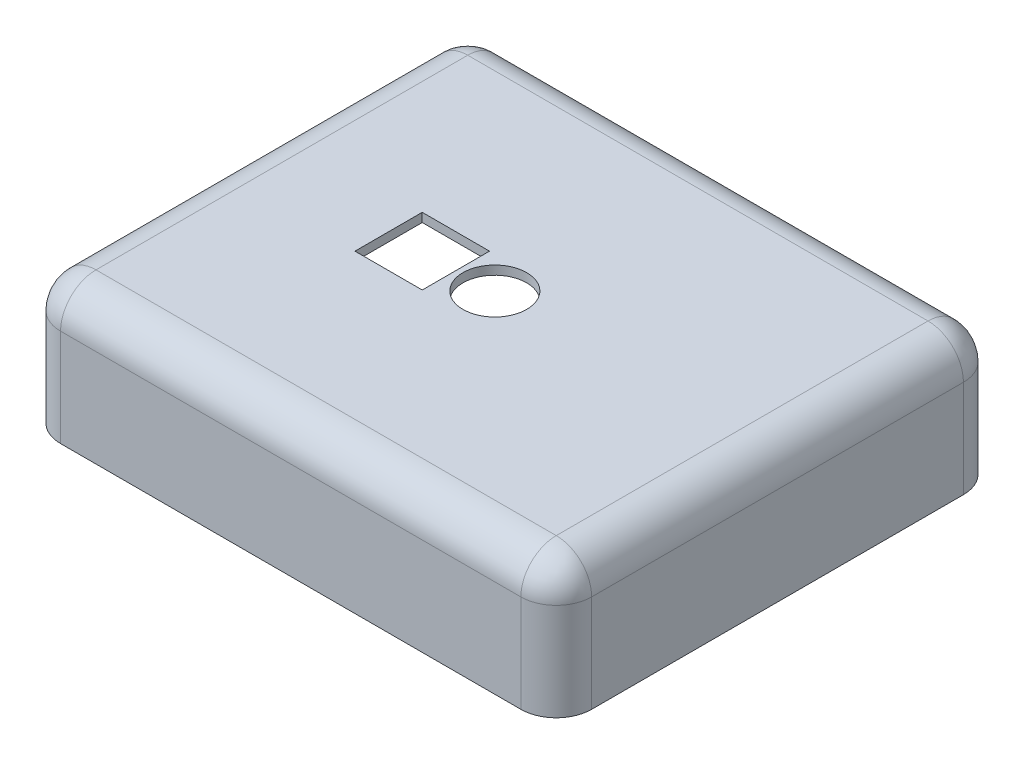
from build123d import *

# Parameters (mm, degrees)
BOSS_EXTRUDE1_DEPTH      = 0.000254
BOSS_EXTRUDE1_DEPTH_BACK = 19.05
SKETCH2_W                = 76.2
SKETCH2_H                = 63.5
SKETCH3_W                = 71.12
SKETCH3_H                = 58.42
CUT_EXTRUDE2_DEPTH       = 17.78
CUT_EXTRUDE3_DEPTH       = 2.54
CUT_EXTRUDE3_DEPTH_BACK  = 102.002933126
SKETCH2_3_R              = 4.572
SKETCH2_3_W              = 9.652
SKETCH2_3_H              = 9.652
FILLET1_R                = 5.08
FILLET2_R                = 5.08
FILLET3_R                = 5.08
FILLET4_R                = 5.08
FILLET5_R                = 5.08
FILLET6_R                = 5.08
CUT_EXTRUDE4_DEPTH       = 5.08


with BuildPart() as part:
    # Sketch2 → Boss-Extrude1 (new, two sides: drawn at the far end of the back side and taken through both)
    with BuildSketch(Plane(origin=(0, 0, 0), x_dir=(1, 0, 0), z_dir=(0, 1, 0)).offset(-BOSS_EXTRUDE1_DEPTH_BACK)):
        with Locations((38.1, 31.75)):
            Rectangle(SKETCH2_W, SKETCH2_H)
    extrude(amount=BOSS_EXTRUDE1_DEPTH + BOSS_EXTRUDE1_DEPTH_BACK)

    # Sketch3 → Cut-Extrude2 (cut)
    with BuildSketch(Plane(origin=(0, -19.05, 0), x_dir=(-1, 0, 0), z_dir=(0, -1, 0))):
        with Locations((-38.1, 31.75)):
            Rectangle(SKETCH3_W, SKETCH3_H)
    extrude(amount=-CUT_EXTRUDE2_DEPTH, mode=Mode.SUBTRACT)

    # Sketch2<3> → Cut-Extrude3 (cut, two sides: drawn at the far end of the back side and taken through both)
    with BuildSketch(Plane(origin=(0, 0, 0), x_dir=(1, 0, 0), z_dir=(0, 1, 0)).offset(-CUT_EXTRUDE3_DEPTH_BACK)):
        with Locations((36.322, 31.064)):
            Circle(SKETCH2_3_R)
        with Locations((26.162, 30.81)):
            Rectangle(SKETCH2_3_W, SKETCH2_3_H)
    extrude(amount=CUT_EXTRUDE3_DEPTH + CUT_EXTRUDE3_DEPTH_BACK, mode=Mode.SUBTRACT)

    # Fillet1
    fillet1_edges = [part.edges().sort_by_distance(p)[0] for p in [
        (76.2, -9.524873, -63.5),
    ]]
    fillet(fillet1_edges, radius=FILLET1_R)

    # Fillet2
    fillet2_edges = [part.edges().sort_by_distance(p)[0] for p in [
        (73.66, -10.16, -60.96),
    ]]
    fillet(fillet2_edges, radius=FILLET2_R)

    # Fillet3
    fillet3_edges = [part.edges().sort_by_distance(p)[0] for p in [
        (76.2, -9.524873, 0),
        (73.66, -10.16, -2.54),
    ]]
    fillet(fillet3_edges, radius=FILLET3_R)

    # Fillet4
    fillet4_edges = [part.edges().sort_by_distance(p)[0] for p in [
        (0, -9.524873, 0),
        (2.54, -10.16, -2.54),
    ]]
    fillet(fillet4_edges, radius=FILLET4_R)

    # Fillet5
    fillet5_edges = [part.edges().sort_by_distance(p)[0] for p in [
        (0, -9.524873, -63.5),
        (2.54, -10.16, -60.96),
    ]]
    fillet(fillet5_edges, radius=FILLET5_R)

    # Fillet6
    fillet6_edges = [part.edges().sort_by_distance(p)[0] for p in [
        (1.487897552, 0.000254, -1.487897552),
        (38.1, 0.000254, 0),
        (74.712102448, 0.000254, -1.487897552),
        (76.2, 0.000254, -31.75),
        (74.712102448, 0.000254, -62.012102448),
        (38.1, 0.000254, -63.5),
        (1.487897552, 0.000254, -62.012102448),
        (0, 0.000254, -31.75),
    ]]
    fillet(fillet6_edges, radius=FILLET6_R)

    # Sketch5 → Cut-Extrude4 (cut)
    with BuildSketch(Plane.XZ.offset(19.05)):
        with BuildLine():
            Line((1.27, -7.62), (1.27, -55.88))
            ThreePointArc((1.27, -55.88), (3.129871939, -60.370128061), (7.62, -62.23))
            Line((7.62, -62.23), (68.58, -62.23))
            ThreePointArc((68.58, -62.23), (73.070128061, -60.370128061), (74.93, -55.88))
            Line((74.93, -55.88), (74.93, -7.62))
            ThreePointArc((74.93, -7.62), (73.070128061, -3.129871939), (68.58, -1.27))
            Line((68.58, -1.27), (7.62, -1.27))
            ThreePointArc((7.62, -1.27), (3.129871939, -3.129871939), (1.27, -7.62))
        make_face()
    extrude(amount=-CUT_EXTRUDE4_DEPTH, mode=Mode.SUBTRACT)


solid = part.part
